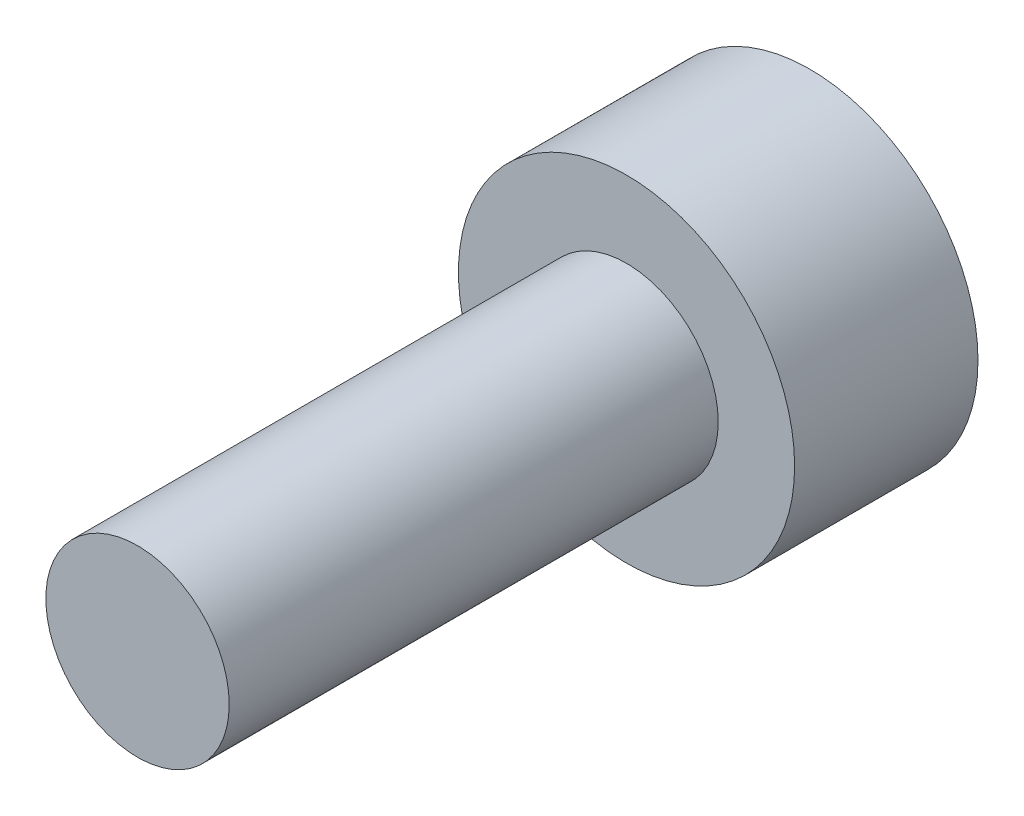
from build123d import *

# Parameters (mm, degrees)
F_01_START                = -3
S01_HEAD_R                = 2.75
F_01_HEAD_DEPTH           = 3
S02_NOMINAL_SHANK_R       = 1.5
F_02_NOMINAL_SHANK_DEPTH  = 8
F_03_START                = -3.1
F_03_HEX_KEY_SOCKET_DEPTH = 1.75


with BuildPart() as part:
    # S01 - Head → 01 - Head (new body)
    with BuildSketch(Plane.XY.offset(F_01_START)):
        Circle(S01_HEAD_R)
    extrude(amount=F_01_HEAD_DEPTH)

    # S02 - Nominal shank → 02 - Nominal shank (add)
    with BuildSketch(Plane.XY):
        Circle(S02_NOMINAL_SHANK_R)
    extrude(amount=F_02_NOMINAL_SHANK_DEPTH)

    # S03 - Hex key socket → 03 - Hex key socket (cut)
    with BuildSketch(Plane.XY.offset(F_03_START)):
        Polygon((1.443375673, 0), (0.721687836, 1.25), (-0.721687836, 1.25), (-1.443375673, 0), (-0.721687836, -1.25), (0.721687836, -1.25), align=None)
    extrude(amount=F_03_HEX_KEY_SOCKET_DEPTH, mode=Mode.SUBTRACT)


solid = part.part
